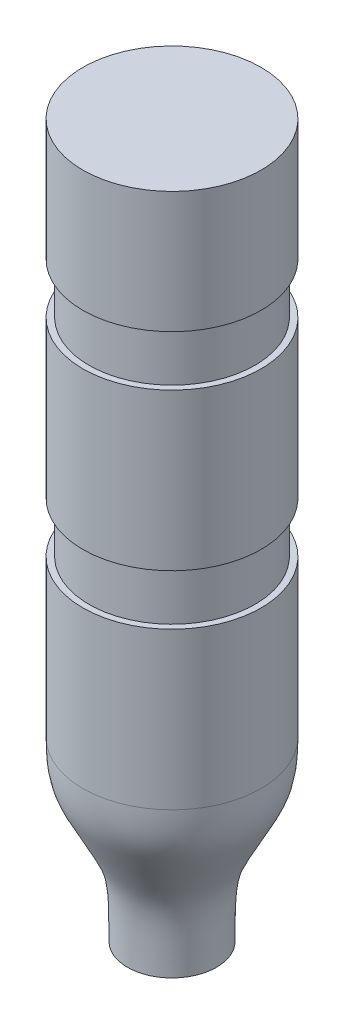
from build123d import *


with BuildPart() as part:
    # Sketch1 → Revolve1 (revolve)
    with BuildSketch(Plane.XY, mode=Mode.PRIVATE) as revolve1_sk:
        with BuildLine():
            Line((0, 0), (11.176, 0))
            Line((11.176, 0), (11.176, -15.24))
            Line((11.176, -15.24), (10.414, -15.24))
            Line((10.414, -15.24), (10.414, -21.59))
            Line((10.414, -21.59), (11.176, -21.59))
            Line((11.176, -21.59), (11.176, -41.215894229))
            Line((11.176, -41.215894229), (10.414, -41.215894229))
            Line((10.414, -41.215894229), (10.414, -47.565894229))
            Line((10.414, -47.565894229), (11.176, -47.565894229))
            Line((11.176, -47.565894229), (11.176, -67.191788457))
            add(Edge.make_bspline(
                [(11.176, -67.191788457), (11.176, -70.951410921), (10.182939744, -73.257982378), (5.810891639, -81.176539717), (5.588, -82.94585867), (5.588, -89.408)],
                knots=[0, 0, 0, 0, 0.316449847, 0.542190509, 1, 1, 1, 1], degree=3))
            Line((5.588, -89.408), (0, -89.408))
            Line((0, -89.408), (0, 0))
        make_face()
    revolve(revolve1_sk.sketch.rotate(Axis((0, -89.408, 0), (0, 1, 0)), 90), axis=Axis((0, -89.408, 0), (0, 1, 0)))


solid = part.part
